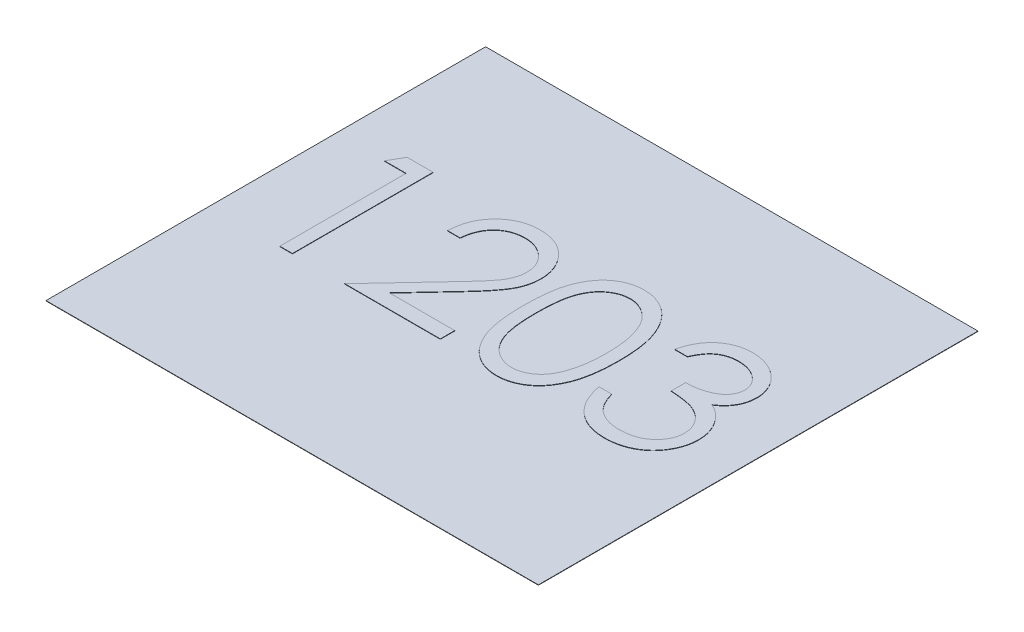
from build123d import *

# Parameters (mm, degrees)
ESBO_O1_W                = 1.4
ESBO_O1_H                = 1.25
RESSALTO_EXTRUS_O1_DEPTH = 0.001
RESSALTO_EXTRUS_O2_DEPTH = 0.001


with BuildPart() as part:
    # Esboço1 → Ressalto-extrusão1 (new body)
    with BuildSketch(Plane(origin=(0, 0, 0), x_dir=(1, 0, 0), z_dir=(0, 1, 0))):
        with Locations((-0.7, 0.625)):
            Rectangle(ESBO_O1_W, ESBO_O1_H)
    extrude(amount=RESSALTO_EXTRUS_O1_DEPTH)

    # Esboço2 → Ressalto-extrusão2 (add)
    # profile 1 of 4: a face of its own
    with BuildSketch(Plane(origin=(0, 0.001, 0), x_dir=(1, 0, 0), z_dir=(0, 1, 0))):
        Polygon((-1.238516477, 0.865245874), (-1.164558144, 0.865245874), (-1.164558144, 0.465245874), (-1.20045558, 0.465245874), (-1.20045558, 0.824220233), (-1.261994041, 0.824220233), align=None)
    # profile 2 of 4: a face of its own
    with BuildSketch(Plane(origin=(0, 0.001, 0), x_dir=(1, 0, 0), z_dir=(0, 1, 0))):
        with BuildLine():
            Line((-0.964558144, 0.742168951), (-1.00045558, 0.742168951))
            add(Edge.make_bspline(
                [(-1.00045558, 0.742168951), (-1.00022162, 0.746931339), (-0.999762128, 0.75628454), (-0.997610323, 0.769921558), (-0.994531366, 0.782956392), (-0.990178057, 0.795284382), (-0.984771625, 0.807014532), (-0.978288193, 0.818100248), (-0.970608896, 0.828499241), (-0.961899555, 0.838115109), (-0.952440282, 0.846936545), (-0.942233889, 0.854554287), (-0.931508743, 0.860990593), (-0.920297383, 0.866371306), (-0.908473319, 0.870410146), (-0.896143849, 0.873406904), (-0.883254805, 0.875209915), (-0.874473088, 0.875403719), (-0.870006862, 0.875502285)],
                knots=[0, 0, 0, 0, 1.10065271, 2.161652631, 3.183658789, 4.190468796, 5.17591951, 6.163126047, 7.15150782, 8.156236427, 9.156009102, 10.134482811, 11.092018607, 12.041330605, 13.001268258, 13.972401359, 14.968799086, 16, 16, 16, 16], degree=3))
            add(Edge.make_bspline(
                [(-0.870006862, 0.875502285), (-0.865620796, 0.875399604), (-0.857002334, 0.87519784), (-0.844423818, 0.873465151), (-0.83244927, 0.870751369), (-0.821102097, 0.866943893), (-0.810472832, 0.861825673), (-0.800481627, 0.855677382), (-0.791009535, 0.848566545), (-0.782483045, 0.84019468), (-0.77465355, 0.831257265), (-0.767899007, 0.82171579), (-0.762114645, 0.811861015), (-0.757293196, 0.801617792), (-0.753743923, 0.790889674), (-0.751049271, 0.779832851), (-0.749526138, 0.768332873), (-0.749292375, 0.760549266), (-0.749173529, 0.756592028)],
                knots=[0, 0, 0, 0, 1.111607364, 2.184268762, 3.212621178, 4.221274766, 5.211760367, 6.196651075, 7.1921475, 8.207485113, 9.220403448, 10.201281604, 11.166441695, 12.114753415, 13.065576456, 14.026450734, 14.996634279, 16, 16, 16, 16], degree=3))
            add(Edge.make_bspline(
                [(-0.749173529, 0.756592028), (-0.749367044, 0.751020847), (-0.74975068, 0.739976251), (-0.753032323, 0.723745981), (-0.758157639, 0.708021019), (-0.764328765, 0.695365327), (-0.770554187, 0.685167214), (-0.776164188, 0.676770791), (-0.782731595, 0.667730166), (-0.790351995, 0.658075613), (-0.798867752, 0.647731509), (-0.808355999, 0.636704104), (-0.818884397, 0.62510733), (-0.82627394, 0.61718669), (-0.830103016, 0.613082413)],
                knots=[0, 0, 0, 0, 1.184426356, 2.348067706, 3.509069118, 4.696110526, 5.333549288, 6.050745305, 6.844228056, 7.710549037, 8.667450064, 9.695053472, 10.805634456, 12, 12, 12, 12], degree=3))
            Line((-0.830103016, 0.613082413), (-0.930183144, 0.506271515))
            Line((-0.930183144, 0.506271515), (-0.744045323, 0.506271515))
            Line((-0.744045323, 0.506271515), (-0.744045323, 0.465245874))
            Line((-0.744045323, 0.465245874), (-1.015840195, 0.465245874))
            Line((-1.015840195, 0.465245874), (-0.86071199, 0.630790746))
            add(Edge.make_bspline(
                [(-0.86071199, 0.630790746), (-0.856935089, 0.63473341), (-0.849680434, 0.64230646), (-0.839419568, 0.653362798), (-0.830203684, 0.663619888), (-0.821973125, 0.673058351), (-0.814906438, 0.681816245), (-0.808635326, 0.689609925), (-0.803610687, 0.696781862), (-0.798157499, 0.705095075), (-0.792875901, 0.715245054), (-0.788337346, 0.727648904), (-0.785569935, 0.740417733), (-0.785237954, 0.749046538), (-0.785070965, 0.7533869)],
                knots=[0, 0, 0, 0, 1.329631726, 2.553950428, 3.673215718, 4.687767853, 5.603093632, 6.413772471, 7.123043292, 7.734684054, 8.834405432, 9.900288307, 10.943827018, 12, 12, 12, 12], degree=3))
            add(Edge.make_bspline(
                [(-0.785070965, 0.7533869), (-0.785143621, 0.756116203), (-0.785286812, 0.761495134), (-0.786550549, 0.769381507), (-0.788460321, 0.776988914), (-0.791196922, 0.784340756), (-0.794809121, 0.791363116), (-0.799206079, 0.798064543), (-0.804279229, 0.804543282), (-0.810147945, 0.810617944), (-0.816594976, 0.816181511), (-0.823405748, 0.821109977), (-0.830611474, 0.825228733), (-0.838181773, 0.828605133), (-0.846095541, 0.831253748), (-0.854368084, 0.833089014), (-0.862976543, 0.834241298), (-0.868854657, 0.834397203), (-0.871849811, 0.834476644)],
                knots=[0, 0, 0, 0, 0.991446411, 1.95395049, 2.89581595, 3.838931463, 4.798493298, 5.75982156, 6.748411868, 7.785213223, 8.824556874, 9.840280684, 10.836137867, 11.835679398, 12.848801643, 13.863922112, 14.911575587, 16, 16, 16, 16], degree=3))
            add(Edge.make_bspline(
                [(-0.871849811, 0.834476644), (-0.874977906, 0.834394926), (-0.881120968, 0.834234445), (-0.890140286, 0.833111855), (-0.898744375, 0.831175187), (-0.906954878, 0.828526425), (-0.914785688, 0.825159733), (-0.922198722, 0.820966391), (-0.929177338, 0.815962563), (-0.935734655, 0.810289357), (-0.941776252, 0.80397306), (-0.947084467, 0.796931921), (-0.95172264, 0.789294502), (-0.955769409, 0.781081411), (-0.959055774, 0.772218121), (-0.961566991, 0.762736098), (-0.963554059, 0.752676512), (-0.96421789, 0.745729645), (-0.964558144, 0.742168951)],
                knots=[0, 0, 0, 0, 1.031018746, 2.02475058, 2.990194455, 3.934040569, 4.864654155, 5.795059489, 6.735614925, 7.690564532, 8.649604399, 9.611025574, 10.590972636, 11.591080095, 12.624614302, 13.701020113, 14.821632451, 16, 16, 16, 16], degree=3))
        make_face()
    # profile 3 of 4: a face of its own
    with BuildSketch(Plane(origin=(0, 0.001, 0), x_dir=(1, 0, 0), z_dir=(0, 1, 0))):
        with BuildLine():
            add(Edge.make_bspline(
                [(-0.708147888, 0.665085618), (-0.7081104, 0.671496748), (-0.708037579, 0.683950461), (-0.707227474, 0.702097277), (-0.705881721, 0.71912131), (-0.704037449, 0.735023375), (-0.701793109, 0.749807576), (-0.698797053, 0.763434406), (-0.695389876, 0.775966932), (-0.691441025, 0.787446023), (-0.686985277, 0.798026332), (-0.682135648, 0.807903498), (-0.676699671, 0.817062576), (-0.670988024, 0.825649752), (-0.664769501, 0.83352446), (-0.658221068, 0.840797907), (-0.65108714, 0.847301993), (-0.643610224, 0.853227285), (-0.635722628, 0.85842151), (-0.627649181, 0.86299668), (-0.619334312, 0.866905236), (-0.610755319, 0.869978429), (-0.601989313, 0.872516812), (-0.593005648, 0.874252691), (-0.583789492, 0.875344909), (-0.577568757, 0.875449329), (-0.574413913, 0.875502285)],
                knots=[0, 0, 0, 0, 1.646270934, 3.197905019, 4.663502075, 6.030701355, 7.308322542, 8.50163776, 9.611534131, 10.641858119, 11.616356847, 12.558055219, 13.465016945, 14.349605745, 15.204443733, 16.039544428, 16.859896111, 17.680448484, 18.487036065, 19.28249412, 20.06191084, 20.843045899, 21.620316918, 22.403196591, 23.190181807, 24, 24, 24, 24], degree=3))
            add(Edge.make_bspline(
                [(-0.574413913, 0.875502285), (-0.571232716, 0.875446534), (-0.564906315, 0.875335665), (-0.555553129, 0.874270071), (-0.546416022, 0.872501943), (-0.537533949, 0.869996689), (-0.528833951, 0.866888611), (-0.520384076, 0.862992941), (-0.512131838, 0.858458213), (-0.504208376, 0.85312977), (-0.496526706, 0.847188938), (-0.48927551, 0.840473205), (-0.482454129, 0.83305038), (-0.475976951, 0.824999881), (-0.47002774, 0.8161673), (-0.464362205, 0.806706259), (-0.459291115, 0.796451303), (-0.454407152, 0.785573535), (-0.450191497, 0.773771974), (-0.44638964, 0.761113144), (-0.443317758, 0.747447523), (-0.440758984, 0.732846809), (-0.43877671, 0.717257382), (-0.43733298, 0.700712661), (-0.436570342, 0.683201759), (-0.436426719, 0.671229433), (-0.436353016, 0.665085618)],
                knots=[0, 0, 0, 0, 0.810914788, 1.612654377, 2.396697861, 3.181598691, 3.963628158, 4.749916497, 5.551656086, 6.361998678, 7.18212741, 8.025565596, 8.878627764, 9.750805457, 10.657531673, 11.591944965, 12.560506719, 13.57287815, 14.630710178, 15.753379473, 16.941251878, 18.199788006, 19.531962791, 20.947069417, 22.433333509, 24, 24, 24, 24], degree=3))
            add(Edge.make_bspline(
                [(-0.436353016, 0.665085618), (-0.436427483, 0.6589686), (-0.436572578, 0.64704984), (-0.43732443, 0.629617728), (-0.438805417, 0.613160809), (-0.440657987, 0.597639613), (-0.443223811, 0.583118743), (-0.446378687, 0.569547949), (-0.449881581, 0.556868626), (-0.454205558, 0.545184648), (-0.45893821, 0.534333022), (-0.464087376, 0.524199634), (-0.469603927, 0.514694915), (-0.47561407, 0.505894944), (-0.482020174, 0.497737383), (-0.48895935, 0.490366226), (-0.496235988, 0.483603863), (-0.503940264, 0.477586534), (-0.511987299, 0.4723197), (-0.520211193, 0.467609545), (-0.528757865, 0.463811523), (-0.537433632, 0.460550375), (-0.546362588, 0.458058895), (-0.555533604, 0.456336169), (-0.564900031, 0.455127958), (-0.571231638, 0.455035789), (-0.574413913, 0.454989464)],
                knots=[0, 0, 0, 0, 1.561518951, 3.042555995, 4.452378317, 5.7783523, 7.031515105, 8.214008947, 9.334062868, 10.386615937, 11.391082383, 12.354592575, 13.286541444, 14.194233754, 15.072674879, 15.931287219, 16.775624067, 17.606195743, 18.42308326, 19.229000347, 20.022332153, 20.807536673, 21.593273796, 22.3848459, 23.188221202, 24, 24, 24, 24], degree=3))
            add(Edge.make_bspline(
                [(-0.574413913, 0.454989464), (-0.577568669, 0.455042762), (-0.583789232, 0.455147855), (-0.593006652, 0.456235138), (-0.601953217, 0.457983196), (-0.610673075, 0.460430808), (-0.619210962, 0.463426789), (-0.627450538, 0.467330067), (-0.635483416, 0.471825389), (-0.643288165, 0.476944866), (-0.650718126, 0.482810201), (-0.65781511, 0.489297549), (-0.664400826, 0.496568796), (-0.670530437, 0.50450913), (-0.676356047, 0.5130455), (-0.681714833, 0.522294457), (-0.686671502, 0.532219327), (-0.691202186, 0.542884231), (-0.695219177, 0.554444794), (-0.698767486, 0.567033272), (-0.701569104, 0.580760773), (-0.703967156, 0.595517044), (-0.705901371, 0.611365493), (-0.707221866, 0.628314724), (-0.708038016, 0.646354177), (-0.708110595, 0.658727865), (-0.708147888, 0.665085618)],
                knots=[0, 0, 0, 0, 0.810891512, 1.598919785, 2.382837074, 3.152667961, 3.926044502, 4.706494248, 5.493654104, 6.291793342, 7.103789334, 7.925228297, 8.761435821, 9.622817696, 10.50288917, 11.416980706, 12.369136599, 13.353924996, 14.394355917, 15.514179734, 16.714354668, 17.994756427, 19.357759367, 20.818452758, 22.365282078, 24, 24, 24, 24], degree=3))
        make_face()
        with BuildLine():
            add(Edge.make_bspline(
                [(-0.672250452, 0.665245874), (-0.672236801, 0.659903166), (-0.672210306, 0.649534018), (-0.671518169, 0.634466217), (-0.670575286, 0.620412465), (-0.669359137, 0.607354918), (-0.667553086, 0.595337774), (-0.665529453, 0.584278381), (-0.663066814, 0.574235268), (-0.660153098, 0.565139519), (-0.656834344, 0.556836768), (-0.653210817, 0.549110915), (-0.649318163, 0.541870694), (-0.644961688, 0.535181138), (-0.64021711, 0.529020434), (-0.635191594, 0.523279539), (-0.629697585, 0.518159884), (-0.622097157, 0.512019672), (-0.612063274, 0.505674628), (-0.599420937, 0.50014936), (-0.586430257, 0.49667708), (-0.577612971, 0.496235508), (-0.57321199, 0.496015105)],
                knots=[0, 0, 0, 0, 1.459021318, 2.831673884, 4.118529203, 5.306027144, 6.411944654, 7.436330062, 8.375795394, 9.233974572, 10.042671642, 10.816086306, 11.563610507, 12.285937304, 12.993564865, 13.685989202, 14.367179055, 15.041617293, 16.353048772, 17.594441528, 18.799311195, 20, 20, 20, 20], degree=3))
            add(Edge.make_bspline(
                [(-0.57321199, 0.496015105), (-0.568782542, 0.496197709), (-0.559932791, 0.496562539), (-0.547003214, 0.500082394), (-0.534451183, 0.505393199), (-0.52461439, 0.511672914), (-0.517130671, 0.517653294), (-0.511768729, 0.522752111), (-0.506847352, 0.528461353), (-0.502179686, 0.534621273), (-0.497898649, 0.541349557), (-0.494005719, 0.548613851), (-0.490453337, 0.556434329), (-0.488429446, 0.561893727), (-0.487394682, 0.564684977)],
                knots=[0, 0, 0, 0, 1.353760809, 2.704726607, 4.075137775, 5.516104923, 6.260822281, 7.007110065, 7.778089737, 8.566572457, 9.372053459, 10.217411131, 11.088608312, 12, 12, 12, 12], degree=3))
            add(Edge.make_bspline(
                [(-0.487394682, 0.564684977), (-0.486188766, 0.56825409), (-0.483740239, 0.57550092), (-0.480584607, 0.586742481), (-0.478099419, 0.598537082), (-0.475863606, 0.610814238), (-0.474337542, 0.62366449), (-0.473109221, 0.637048077), (-0.472385714, 0.650975089), (-0.472296028, 0.660437374), (-0.472250452, 0.665245874)],
                knots=[0, 0, 0, 0, 0.884706709, 1.796334032, 2.740027952, 3.714592787, 4.726048262, 5.777819803, 6.87074269, 8, 8, 8, 8], degree=3))
            add(Edge.make_bspline(
                [(-0.472250452, 0.665245874), (-0.47231333, 0.670053597), (-0.472436335, 0.67945853), (-0.472906505, 0.693232037), (-0.474120628, 0.706314066), (-0.475469098, 0.718760977), (-0.477457352, 0.730503869), (-0.479601102, 0.741641047), (-0.48248124, 0.752034536), (-0.485557786, 0.761847059), (-0.489078974, 0.770967134), (-0.492955058, 0.779437281), (-0.497094687, 0.787298392), (-0.501590943, 0.7945289), (-0.50639045, 0.801161191), (-0.511619884, 0.807062287), (-0.517071813, 0.812415083), (-0.524708062, 0.818525091), (-0.534705124, 0.824754999), (-0.547144627, 0.830488229), (-0.560089843, 0.833780605), (-0.568841095, 0.834244798), (-0.57321199, 0.834476644)],
                knots=[0, 0, 0, 0, 1.31362396, 2.569729283, 3.763502607, 4.902122613, 5.988968491, 7.01645872, 7.998833611, 8.933434873, 9.825090667, 10.667526885, 11.477055099, 12.250526234, 12.991942729, 13.710640831, 14.402115721, 15.076753259, 16.378508321, 17.609869233, 18.806226677, 20, 20, 20, 20], degree=3))
            add(Edge.make_bspline(
                [(-0.57321199, 0.834476644), (-0.577636058, 0.834244478), (-0.586492253, 0.833779725), (-0.599572019, 0.830500496), (-0.612109659, 0.824784728), (-0.622080285, 0.818504457), (-0.62972186, 0.812522936), (-0.63510274, 0.807335912), (-0.640148017, 0.801662055), (-0.644795754, 0.795444693), (-0.649148815, 0.788762937), (-0.653146645, 0.781564221), (-0.656748625, 0.773812065), (-0.660072572, 0.765513044), (-0.662995176, 0.756418079), (-0.665405915, 0.746387337), (-0.667633007, 0.73536312), (-0.669209609, 0.723280891), (-0.670611181, 0.710220073), (-0.671511907, 0.696131237), (-0.672212622, 0.681038165), (-0.672237589, 0.670615404), (-0.672250452, 0.665245874)],
                knots=[0, 0, 0, 0, 1.207732386, 2.417664972, 3.655092373, 4.956220595, 5.625982001, 6.301752483, 6.994047911, 7.697131622, 8.419323945, 9.170223765, 9.943494443, 10.752040957, 11.610060368, 12.549350801, 13.567764191, 14.679664412, 15.874934091, 17.154273443, 18.533957287, 20, 20, 20, 20], degree=3))
        make_face(mode=Mode.SUBTRACT)
    # profile 4 of 4: a face of its own
    with BuildSketch(Plane(origin=(0, 0.001, 0), x_dir=(1, 0, 0), z_dir=(0, 1, 0))):
        with BuildLine():
            Line((-0.349173529, 0.772938182), (-0.385070965, 0.772938182))
            add(Edge.make_bspline(
                [(-0.385070965, 0.772938182), (-0.384098444, 0.776964752), (-0.382197247, 0.784836366), (-0.37823181, 0.79608291), (-0.373911895, 0.806725598), (-0.368724569, 0.81656515), (-0.363066426, 0.82579931), (-0.356583829, 0.834218638), (-0.349575861, 0.842037263), (-0.341824438, 0.848975919), (-0.333695448, 0.855259088), (-0.325074349, 0.860616237), (-0.316134589, 0.865224712), (-0.306814231, 0.86902131), (-0.297085526, 0.87188137), (-0.287036426, 0.873956433), (-0.276640598, 0.875303989), (-0.26958373, 0.875435505), (-0.266000452, 0.875502285)],
                knots=[0, 0, 0, 0, 1.162005537, 2.271625781, 3.343758855, 4.383309926, 5.390229558, 6.379919256, 7.361854164, 8.333198761, 9.295911338, 10.242430842, 11.177959212, 12.116337295, 13.062827104, 14.020064771, 14.994644689, 16, 16, 16, 16], degree=3))
            add(Edge.make_bspline(
                [(-0.266000452, 0.875502285), (-0.260779567, 0.875344658), (-0.25045168, 0.875032844), (-0.23527876, 0.87218548), (-0.220647124, 0.86767975), (-0.206716924, 0.861454182), (-0.193777675, 0.853775632), (-0.182264968, 0.844636805), (-0.172334852, 0.834214027), (-0.164004066, 0.822701734), (-0.157481209, 0.810398247), (-0.152671338, 0.797735372), (-0.149743146, 0.784743147), (-0.149363653, 0.775970886), (-0.149173529, 0.771576003)],
                knots=[0, 0, 0, 0, 1.083050992, 2.142477498, 3.193116406, 4.255571735, 5.30263384, 6.308962982, 7.297363603, 8.282367274, 9.249857812, 10.179914175, 11.08814088, 12, 12, 12, 12], degree=3))
            add(Edge.make_bspline(
                [(-0.149173529, 0.771576003), (-0.14930651, 0.767346655), (-0.149566735, 0.759070477), (-0.151776302, 0.74698802), (-0.155494732, 0.735600409), (-0.160645562, 0.724859705), (-0.167313167, 0.714834009), (-0.175390047, 0.705500764), (-0.184933208, 0.696818574), (-0.192165087, 0.69184492), (-0.195888272, 0.689284336)],
                knots=[0, 0, 0, 0, 1.024540389, 2.004866551, 2.965041327, 3.920577974, 4.882998113, 5.874504559, 6.905732034, 8, 8, 8, 8], degree=3))
            add(Edge.make_bspline(
                [(-0.195888272, 0.689284336), (-0.191633215, 0.687229688), (-0.183202715, 0.683158836), (-0.171711226, 0.67517532), (-0.161279468, 0.665957452), (-0.1554619, 0.658764006), (-0.152538913, 0.655149721)],
                knots=[0, 0, 0, 0, 1.015518401, 2.012035669, 3.001164323, 4, 4, 4, 4], degree=3))
            add(Edge.make_bspline(
                [(-0.152538913, 0.655149721), (-0.150614188, 0.652514549), (-0.146796257, 0.647287359), (-0.142083625, 0.638883196), (-0.137808298, 0.630385883), (-0.134476844, 0.621567665), (-0.131896973, 0.612530749), (-0.130052856, 0.603259618), (-0.128907239, 0.593746701), (-0.128743176, 0.587310989), (-0.128660708, 0.584076003)],
                knots=[0, 0, 0, 0, 1.025084078, 2.033381695, 3.024893161, 4.013698104, 4.991890475, 5.976764909, 6.982997093, 8, 8, 8, 8], degree=3))
            add(Edge.make_bspline(
                [(-0.128660708, 0.584076003), (-0.128865795, 0.578474892), (-0.129275005, 0.567299029), (-0.132932613, 0.550787632), (-0.138602698, 0.534647574), (-0.146654919, 0.51921045), (-0.156468349, 0.504766978), (-0.168143471, 0.491843971), (-0.181547632, 0.480735559), (-0.196496849, 0.47145439), (-0.212693093, 0.464035199), (-0.230016017, 0.458885777), (-0.248216024, 0.455531949), (-0.260696858, 0.455172306), (-0.267042118, 0.454989464)],
                knots=[0, 0, 0, 0, 0.955779014, 1.907060117, 2.875433937, 3.871313158, 4.872415639, 5.851225146, 6.836215519, 7.83643374, 8.849228613, 9.86973379, 10.916971861, 12, 12, 12, 12], degree=3))
            add(Edge.make_bspline(
                [(-0.267042118, 0.454989464), (-0.27131861, 0.455088689), (-0.279733319, 0.455283929), (-0.292104004, 0.456618626), (-0.303912199, 0.459056341), (-0.315173867, 0.462336719), (-0.325899014, 0.466495775), (-0.336054912, 0.471675055), (-0.345704042, 0.477767798), (-0.354755351, 0.484845922), (-0.363207759, 0.49276379), (-0.370836642, 0.501661962), (-0.377769189, 0.511375951), (-0.383819777, 0.522018586), (-0.389264, 0.53345233), (-0.393741823, 0.545823587), (-0.397683031, 0.559021761), (-0.399515427, 0.568219217), (-0.40045558, 0.572938182)],
                knots=[0, 0, 0, 0, 1.048658725, 2.063410685, 3.046034179, 4.001477787, 4.936774919, 5.862367409, 6.792675028, 7.730719943, 8.675894397, 9.627829632, 10.600096036, 11.597688215, 12.626045268, 13.701542398, 14.82072376, 16, 16, 16, 16], degree=3))
            Line((-0.40045558, 0.572938182), (-0.364558144, 0.572938182))
            add(Edge.make_bspline(
                [(-0.364558144, 0.572938182), (-0.363622911, 0.569858295), (-0.361803801, 0.563867647), (-0.358707309, 0.555245898), (-0.355179507, 0.54734212), (-0.351394986, 0.540098335), (-0.347420306, 0.533443203), (-0.342972886, 0.527552704), (-0.338382127, 0.522168109), (-0.334921629, 0.519134439), (-0.333228016, 0.517649721)],
                knots=[0, 0, 0, 0, 1.198163088, 2.33053128, 3.407730985, 4.417276592, 5.372219308, 6.28897303, 7.162600585, 8, 8, 8, 8], degree=3))
            add(Edge.make_bspline(
                [(-0.333228016, 0.517649721), (-0.330988407, 0.515923054), (-0.326516103, 0.51247505), (-0.319228305, 0.508074864), (-0.311563746, 0.504262176), (-0.303356355, 0.501349753), (-0.294783238, 0.498883735), (-0.285705825, 0.497269961), (-0.276204201, 0.496162742), (-0.269716456, 0.496065035), (-0.266401093, 0.496015105)],
                knots=[0, 0, 0, 0, 0.946170439, 1.889420265, 2.845303464, 3.807233317, 4.801018734, 5.828864929, 6.890507805, 8, 8, 8, 8], degree=3))
            add(Edge.make_bspline(
                [(-0.266401093, 0.496015105), (-0.262657835, 0.496085494), (-0.255338218, 0.496223134), (-0.244657663, 0.497488929), (-0.234496812, 0.499332405), (-0.224968478, 0.502179603), (-0.215947848, 0.505697415), (-0.207561374, 0.510114375), (-0.199698962, 0.515296629), (-0.192461315, 0.521186819), (-0.185953257, 0.52763499), (-0.180223027, 0.534379341), (-0.175351637, 0.541391436), (-0.171422086, 0.548710078), (-0.168319166, 0.556304961), (-0.1662068, 0.564197399), (-0.164738055, 0.572322801), (-0.164618442, 0.577846112), (-0.164558144, 0.58063049)],
                knots=[0, 0, 0, 0, 1.217147791, 2.380027433, 3.494444702, 4.572153297, 5.609568379, 6.639424714, 7.649109417, 8.668170816, 9.669597737, 10.625200337, 11.543417969, 12.441394052, 13.322311151, 14.205496177, 15.095365482, 16, 16, 16, 16], degree=3))
            add(Edge.make_bspline(
                [(-0.164558144, 0.58063049), (-0.164733036, 0.5843575), (-0.165081949, 0.591792975), (-0.167745786, 0.602732127), (-0.172127371, 0.613271945), (-0.178261372, 0.623232607), (-0.185728312, 0.632464138), (-0.19445573, 0.640700879), (-0.204516099, 0.647497461), (-0.213775513, 0.652193308), (-0.221977245, 0.655397545), (-0.228996146, 0.657531826), (-0.236854044, 0.659339101), (-0.245455912, 0.661020504), (-0.254866565, 0.662451515), (-0.265075758, 0.663644865), (-0.27608556, 0.664599727), (-0.283707407, 0.665026138), (-0.287635067, 0.665245874)],
                knots=[0, 0, 0, 0, 1.07054697, 2.135767047, 3.216561865, 4.33974944, 5.486079747, 6.621378074, 7.775625952, 8.963672916, 9.598146892, 10.304877434, 11.070270905, 11.915000392, 12.823868403, 13.805723172, 14.86925407, 16, 16, 16, 16], degree=3))
            Line((-0.287635067, 0.665245874), (-0.287635067, 0.706271515))
            add(Edge.make_bspline(
                [(-0.287635067, 0.706271515), (-0.282686362, 0.706355493), (-0.272993066, 0.706519984), (-0.258833717, 0.708509471), (-0.245293909, 0.711261543), (-0.23267371, 0.715476994), (-0.221171, 0.720373028), (-0.211191617, 0.726070423), (-0.202875372, 0.732403537), (-0.196262678, 0.739470121), (-0.191287909, 0.747048984), (-0.187650561, 0.75494803), (-0.185501952, 0.763236494), (-0.185215133, 0.768893028), (-0.185070965, 0.771736259)],
                knots=[0, 0, 0, 0, 1.321986639, 2.589447074, 3.816329219, 5.01088745, 6.139805852, 7.153945165, 8.075214402, 8.924034688, 9.728124013, 10.488707548, 11.240355623, 12, 12, 12, 12], degree=3))
            add(Edge.make_bspline(
                [(-0.185070965, 0.771736259), (-0.185118326, 0.773825144), (-0.185212549, 0.777980882), (-0.186400809, 0.784052319), (-0.188186414, 0.789938141), (-0.19064124, 0.795613319), (-0.193926977, 0.801038493), (-0.19785909, 0.806259916), (-0.202541158, 0.811247777), (-0.207906352, 0.815896956), (-0.213667701, 0.820327726), (-0.219981961, 0.824089285), (-0.226658747, 0.827305863), (-0.23370545, 0.829958378), (-0.24114494, 0.831953725), (-0.248942261, 0.833386392), (-0.257112281, 0.834282124), (-0.262686194, 0.834411086), (-0.265519682, 0.834476644)],
                knots=[0, 0, 0, 0, 0.884392785, 1.759457502, 2.611959086, 3.489218968, 4.37281399, 5.2945488, 6.255912374, 7.266815255, 8.301784654, 9.332968512, 10.37626691, 11.440494194, 12.520033166, 13.637162961, 14.798855837, 16, 16, 16, 16], degree=3))
            add(Edge.make_bspline(
                [(-0.265519682, 0.834476644), (-0.270074159, 0.834317631), (-0.27897011, 0.834007042), (-0.291794672, 0.831286698), (-0.303716882, 0.826946345), (-0.312829872, 0.821765429), (-0.319559309, 0.816651093), (-0.324368102, 0.812184535), (-0.329090446, 0.807220784), (-0.333415667, 0.801454112), (-0.337789835, 0.79527505), (-0.341772071, 0.788369487), (-0.34564175, 0.780917556), (-0.34797347, 0.775649483), (-0.349173529, 0.772938182)],
                knots=[0, 0, 0, 0, 1.472543308, 2.876219568, 4.221790263, 5.565193594, 6.249813518, 6.953379497, 7.687249741, 8.463570142, 9.283606569, 10.136032583, 11.040678096, 12, 12, 12, 12], degree=3))
        make_face()
    extrude(amount=RESSALTO_EXTRUS_O2_DEPTH)


solid = part.part
